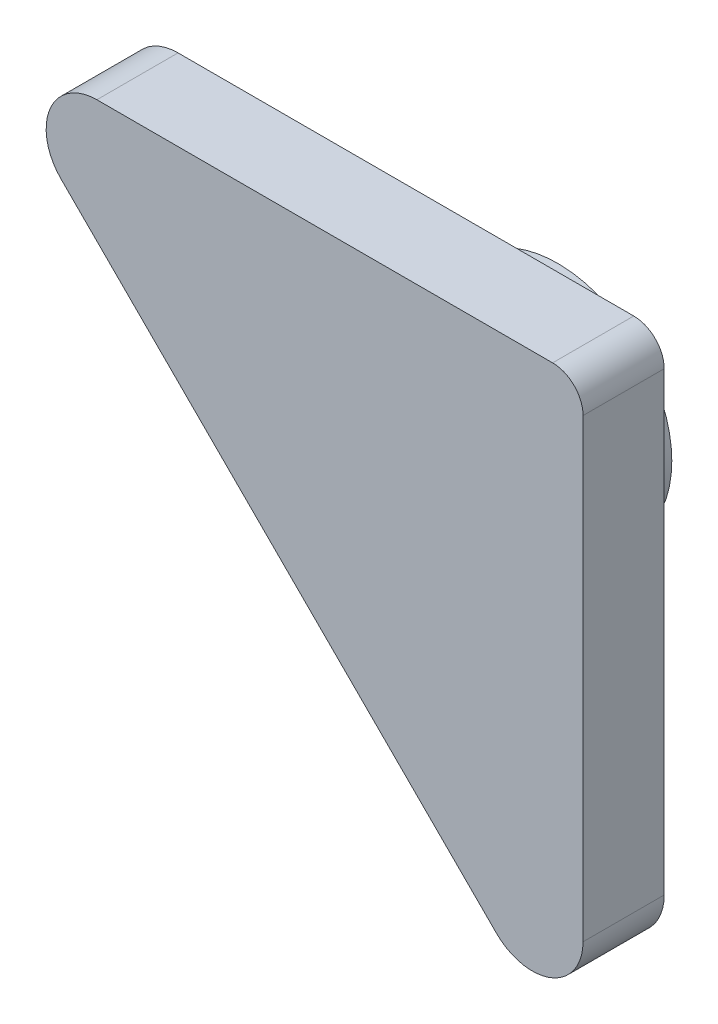
from build123d import *

# Parameters (mm, degrees)
BOSS_EXTRUDE1_DEPTH = 8
SKETCH2_R           = 11.25
BOSS_EXTRUDE2_DEPTH = 6
CUT_EXTRUDE1_START  = -0.8
SKETCH3_R           = 10.2
CUT_EXTRUDE1_DEPTH  = 5.2
FILLET1_R           = 5
FILLET2_R           = 3
SKETCH4_R           = 1.9
CUT_EXTRUDE2_DEPTH  = 4
CUT_EXTRUDE3_DEPTH  = 1


with BuildPart() as part:
    # Sketch1 → Boss-Extrude1 (new body)
    with BuildSketch(Plane.XY):
        Polygon((-43.5, 16.5), (16.5, 16.5), (16.5, -43.5), align=None)
    extrude(amount=BOSS_EXTRUDE1_DEPTH)

    # Sketch2 → Boss-Extrude2 (add)
    with BuildSketch(Plane.XY):
        Circle(SKETCH2_R)
    extrude(amount=-BOSS_EXTRUDE2_DEPTH)

    # Sketch3 → Cut-Extrude1 (cut)
    with BuildSketch(Plane(origin=(0, 0, -6), x_dir=(-1, 0, 0), z_dir=(0, 0, -1)).offset(CUT_EXTRUDE1_START)):
        Circle(SKETCH3_R)
    extrude(amount=-CUT_EXTRUDE1_DEPTH, mode=Mode.SUBTRACT)

    # Fillet1
    fillet1_edges = [part.edges().sort_by_distance(p)[0] for p in [
        (-43.5, 16.5, 4),
        (16.5, -43.5, 4),
    ]]
    fillet(fillet1_edges, radius=FILLET1_R)

    # Fillet2
    fillet2_edges = [part.edges().sort_by_distance(p)[0] for p in [
        (16.5, 16.5, 4),
    ]]
    fillet(fillet2_edges, radius=FILLET2_R)

    # Sketch4 → Cut-Extrude2 (cut)
    with BuildSketch(Plane(origin=(0, 0, 0), x_dir=(-1, 0, 0), z_dir=(0, 0, -1))):
        with Locations((28, 8)):
            Circle(SKETCH4_R)
    extrude(amount=-CUT_EXTRUDE2_DEPTH, mode=Mode.SUBTRACT)

    # Sketch5 → Cut-Extrude3 (cut)
    # profile 1 of 4: a face of its own
    with BuildSketch(Plane(origin=(0, 0, 0), x_dir=(-1, 0, 0), z_dir=(0, 0, -1))):
        with BuildLine():
            Line((-11.659528314, -16.419260987), (-11.973630878, -16.419260987))
            add(Edge.make_bspline(
                [(-11.973630878, -16.419260987), (-11.971583725, -16.377590099), (-11.967563171, -16.295749584), (-11.948734882, -16.176425678), (-11.921794004, -16.062370879), (-11.88370255, -15.954500965), (-11.836396273, -15.851862158), (-11.779666245, -15.754862142), (-11.712472395, -15.663870954), (-11.636265661, -15.57973211), (-11.553497022, -15.50254454), (-11.464191082, -15.435889297), (-11.370346055, -15.379571625), (-11.272246656, -15.332490384), (-11.168786092, -15.297150538), (-11.060903235, -15.270928898), (-10.948124098, -15.255152552), (-10.871284076, -15.253456767), (-10.832204596, -15.25259432)],
                knots=[0, 0, 0, 0, 1.10065271, 2.161652631, 3.183658789, 4.190468796, 5.17591951, 6.163126047, 7.15150782, 8.156236427, 9.156009102, 10.134482811, 11.092018607, 12.041330605, 13.001268258, 13.972401359, 14.968799086, 16, 16, 16, 16], degree=3))
            add(Edge.make_bspline(
                [(-10.832204596, -15.25259432), (-10.793826522, -15.253492777), (-10.718414977, -15.255258211), (-10.608352963, -15.270419241), (-10.503575668, -15.294164832), (-10.404287902, -15.327480249), (-10.311281837, -15.372264676), (-10.223858793, -15.426062215), (-10.140977982, -15.488282046), (-10.066371198, -15.561535859), (-9.997863119, -15.639738244), (-9.938760864, -15.723226148), (-9.8881477, -15.809455433), (-9.84596002, -15.899083635), (-9.814903882, -15.992954663), (-9.791325674, -16.089701866), (-9.77799826, -16.190326677), (-9.775952836, -16.258433233), (-9.774912929, -16.293059064)],
                knots=[0, 0, 0, 0, 1.111607364, 2.184268762, 3.212621178, 4.221274766, 5.211760367, 6.196651075, 7.1921475, 8.207485113, 9.220403448, 10.201281604, 11.166441695, 12.114753415, 13.065576456, 14.026450734, 14.996634279, 16, 16, 16, 16], degree=3))
            add(Edge.make_bspline(
                [(-9.774912929, -16.293059064), (-9.776599574, -16.341808873), (-9.779943266, -16.438453001), (-9.808798968, -16.580657359), (-9.853381065, -16.718562418), (-9.907454095, -16.82954147), (-9.962074662, -16.918518363), (-10.010254458, -16.992434005), (-10.067906811, -17.071260421), (-10.134504224, -17.15579153), (-10.20904203, -17.2462859), (-10.292056698, -17.342780666), (-10.384182389, -17.444250971), (-10.44884057, -17.513556784), (-10.48234482, -17.54946932)],
                knots=[0, 0, 0, 0, 1.184203166, 2.347625244, 3.513805382, 4.700623107, 5.337941753, 6.051866363, 6.845199593, 7.711357327, 8.668078039, 9.695487809, 10.805859518, 12, 12, 12, 12], degree=3))
            Line((-10.48234482, -17.54946932), (-11.358045942, -18.483363551))
            Line((-11.358045942, -18.483363551), (-9.730041134, -18.483363551))
            Line((-9.730041134, -18.483363551), (-9.730041134, -18.84233791))
            Line((-9.730041134, -18.84233791), (-12.108246263, -18.84233791))
            Line((-12.108246263, -18.84233791), (-10.750874468, -17.393820282))
            add(Edge.make_bspline(
                [(-10.750874468, -17.393820282), (-10.717826581, -17.359321975), (-10.654348354, -17.293057788), (-10.564565777, -17.196314828), (-10.483926789, -17.106565288), (-10.411909396, -17.023978739), (-10.350075891, -16.947347171), (-10.295203659, -16.879152468), (-10.251238068, -16.816398017), (-10.203522672, -16.743657404), (-10.157308691, -16.654845086), (-10.117596334, -16.546311397), (-10.093381486, -16.434584144), (-10.090476651, -16.359082107), (-10.089015493, -16.321103935)],
                knots=[0, 0, 0, 0, 1.329631726, 2.553950428, 3.673215718, 4.687767853, 5.603093632, 6.413772471, 7.123043292, 7.734684054, 8.834405432, 9.900288307, 10.943827018, 12, 12, 12, 12], degree=3))
            add(Edge.make_bspline(
                [(-10.089015493, -16.321103935), (-10.089651236, -16.297222537), (-10.090904162, -16.250156887), (-10.101961859, -16.181151128), (-10.118672365, -16.114586314), (-10.142617623, -16.050257695), (-10.174224363, -15.988812043), (-10.212697743, -15.930174562), (-10.257087807, -15.873485597), (-10.308439076, -15.820332299), (-10.364850596, -15.771651094), (-10.424444845, -15.728527008), (-10.48749495, -15.692487898), (-10.553735072, -15.6629444), (-10.622980541, -15.639769019), (-10.695365286, -15.62371044), (-10.770689303, -15.613627956), (-10.822122798, -15.612263784), (-10.848330397, -15.611568679)],
                knots=[0, 0, 0, 0, 0.991446411, 1.95395049, 2.89581595, 3.838931463, 4.798493298, 5.75982156, 6.748411868, 7.785213223, 8.824556874, 9.840280684, 10.836137867, 11.835679398, 12.848801643, 13.863922112, 14.911575587, 16, 16, 16, 16], degree=3))
            add(Edge.make_bspline(
                [(-10.848330397, -15.611568679), (-10.87570123, -15.612283711), (-10.929453026, -15.613687917), (-11.008372059, -15.623510581), (-11.083657837, -15.640456421), (-11.15549974, -15.663633095), (-11.224019325, -15.693091644), (-11.288883369, -15.729783389), (-11.349946259, -15.773566882), (-11.407322782, -15.823207438), (-11.460186761, -15.87847504), (-11.506633637, -15.940085003), (-11.547217651, -16.006912418), (-11.582626885, -16.078776969), (-11.611382575, -16.156330749), (-11.633355725, -16.239298453), (-11.650742572, -16.327319835), (-11.656551092, -16.38810492), (-11.659528314, -16.419260987)],
                knots=[0, 0, 0, 0, 1.031018746, 2.02475058, 2.990194455, 3.934040569, 4.864654155, 5.795059489, 6.735614925, 7.690564532, 8.649604399, 9.611025574, 10.590972636, 11.591080095, 12.624614302, 13.701020113, 14.821632451, 16, 16, 16, 16], degree=3))
        make_face()
    # profile 2 of 4: a face of its own
    with BuildSketch(Plane(origin=(0, 0, 0), x_dir=(-1, 0, 0), z_dir=(0, 0, -1))):
        with BuildLine():
            add(Edge.make_bspline(
                [(-9.41593857, -17.093740153), (-9.415610552, -17.037642766), (-9.414973372, -16.928672781), (-9.407884951, -16.769888139), (-9.396109609, -16.62092785), (-9.379972236, -16.481784784), (-9.360334256, -16.35242302), (-9.334118769, -16.233188263), (-9.304305967, -16.123528656), (-9.269753521, -16.023086608), (-9.230765732, -15.930508905), (-9.188331471, -15.844083703), (-9.140766677, -15.763941771), (-9.090789764, -15.688803981), (-9.036377692, -15.619900286), (-8.979078902, -15.556257623), (-8.916657025, -15.499346873), (-8.851234017, -15.44750057), (-8.782217553, -15.402051099), (-8.711574887, -15.36201836), (-8.638819781, -15.327818493), (-8.563753598, -15.300928057), (-8.48705104, -15.27871721), (-8.408443973, -15.263528263), (-8.327802609, -15.253971354), (-8.273371174, -15.253057686), (-8.245766295, -15.25259432)],
                knots=[0, 0, 0, 0, 1.646270934, 3.197905019, 4.663502075, 6.030701355, 7.308322542, 8.50163776, 9.611534131, 10.641858119, 11.616356847, 12.558055219, 13.465016945, 14.349605745, 15.204443733, 16.039544428, 16.859896111, 17.680448484, 18.487036065, 19.28249412, 20.06191084, 20.843045899, 21.620316918, 22.403196591, 23.190181807, 24, 24, 24, 24], degree=3))
            add(Edge.make_bspline(
                [(-8.245766295, -15.25259432), (-8.217930816, -15.253082135), (-8.162574807, -15.254052246), (-8.080734432, -15.263376189), (-8.00078475, -15.278847312), (-7.923066612, -15.300768286), (-7.846941625, -15.327963963), (-7.773005217, -15.36205108), (-7.700798136, -15.401729948), (-7.631467848, -15.448353825), (-7.564253233, -15.500336101), (-7.50080527, -15.55909877), (-7.441118184, -15.624048489), (-7.384442879, -15.694490353), (-7.332387282, -15.771775438), (-7.282813849, -15.854559548), (-7.238441813, -15.944290412), (-7.195707138, -16.03947088), (-7.158820151, -16.142734539), (-7.125553906, -16.2534993), (-7.098674938, -16.373073486), (-7.076285665, -16.500829732), (-7.058940769, -16.637237215), (-7.046308127, -16.78200353), (-7.039635042, -16.935223921), (-7.038378341, -17.03998177), (-7.037733442, -17.093740153)],
                knots=[0, 0, 0, 0, 0.810914788, 1.612654377, 2.396697861, 3.181598691, 3.963628158, 4.749916497, 5.551656086, 6.361998678, 7.18212741, 8.025565596, 8.878627764, 9.750805457, 10.657531673, 11.591944965, 12.560506719, 13.57287815, 14.630710178, 15.753379473, 16.941251878, 18.199788006, 19.531962791, 20.947069417, 22.433333509, 24, 24, 24, 24], degree=3))
            add(Edge.make_bspline(
                [(-7.037733442, -17.093740153), (-7.038385027, -17.147264061), (-7.039654613, -17.251553213), (-7.046233319, -17.404084189), (-7.05919195, -17.548082232), (-7.075401939, -17.683892694), (-7.097852902, -17.810950313), (-7.125458068, -17.929694762), (-7.156108391, -18.040638833), (-7.193943185, -18.142873645), (-7.235353895, -18.237825368), (-7.280409091, -18.326492516), (-7.328678918, -18.409658809), (-7.381267663, -18.486658556), (-7.437321076, -18.558037213), (-7.498038865, -18.622534835), (-7.56170945, -18.681705507), (-7.629121865, -18.734357135), (-7.699533417, -18.780441939), (-7.771492494, -18.82165579), (-7.846275877, -18.854888485), (-7.92218883, -18.883423526), (-8.000317196, -18.905223978), (-8.080563587, -18.920297833), (-8.162519822, -18.930869682), (-8.217921388, -18.931676162), (-8.245766295, -18.9320815)],
                knots=[0, 0, 0, 0, 1.561518951, 3.042555995, 4.452378317, 5.7783523, 7.031515105, 8.214008947, 9.334062868, 10.386615937, 11.391082383, 12.354592575, 13.286541444, 14.194233754, 15.072674879, 15.931287219, 16.775624067, 17.606195743, 18.42308326, 19.229000347, 20.022332153, 20.807536673, 21.593273796, 22.3848459, 23.188221202, 24, 24, 24, 24], degree=3))
            add(Edge.make_bspline(
                [(-8.245766295, -18.9320815), (-8.273370409, -18.931615144), (-8.327800333, -18.930695582), (-8.408452759, -18.921181851), (-8.486735202, -18.905886347), (-8.563033956, -18.884469743), (-8.637740471, -18.858254907), (-8.709836758, -18.824101223), (-8.780124442, -18.784767155), (-8.848415998, -18.739971733), (-8.913428159, -18.68865005), (-8.975526764, -18.631885761), (-9.033151783, -18.56826235), (-9.086785879, -18.498784427), (-9.137759967, -18.424091185), (-9.18464934, -18.343162811), (-9.228020194, -18.256320201), (-9.267663685, -18.16300229), (-9.302812349, -18.061847362), (-9.333860057, -17.951698184), (-9.358374214, -17.831582548), (-9.37935717, -17.702465181), (-9.396281553, -17.56379125), (-9.407835878, -17.415485472), (-9.414977193, -17.257640263), (-9.415612263, -17.149370489), (-9.41593857, -17.093740153)],
                knots=[0, 0, 0, 0, 0.810891512, 1.598919785, 2.382837074, 3.152667961, 3.926044502, 4.706494248, 5.493654104, 6.291793342, 7.103789334, 7.925228297, 8.761435821, 9.622817696, 10.50288917, 11.416980706, 12.369136599, 13.353924996, 14.394355917, 15.514179734, 16.714354668, 17.994756427, 19.357759367, 20.818452758, 22.365282078, 24, 24, 24, 24], degree=3))
        make_face()
        with BuildLine():
            add(Edge.make_bspline(
                [(-9.101836006, -17.09233791), (-9.101716559, -17.139086609), (-9.101484736, -17.229816653), (-9.095428535, -17.361659914), (-9.087178303, -17.484630243), (-9.076537006, -17.59888378), (-9.060734058, -17.704033792), (-9.04302727, -17.800803475), (-9.02147918, -17.888680712), (-8.995984162, -17.968268523), (-8.966945065, -18.040917592), (-8.935239202, -18.108518807), (-8.901178479, -18.171870743), (-8.863059328, -18.230404352), (-8.821544265, -18.284310516), (-8.777571006, -18.334543348), (-8.729498422, -18.379340329), (-8.662994679, -18.433067184), (-8.575198205, -18.488586318), (-8.464577749, -18.536932408), (-8.350909298, -18.567314864), (-8.273758048, -18.57117862), (-8.235249468, -18.573107141)],
                knots=[0, 0, 0, 0, 1.459021318, 2.831673884, 4.118529203, 5.306027144, 6.411944654, 7.436330062, 8.375795394, 9.233974572, 10.042671642, 10.816086306, 11.563610507, 12.285937304, 12.993564865, 13.685989202, 14.367179055, 15.041617293, 16.353048772, 17.594441528, 18.799311195, 20, 20, 20, 20], degree=3))
            add(Edge.make_bspline(
                [(-8.235249468, -18.573107141), (-8.196491796, -18.57150936), (-8.119056473, -18.568317097), (-8.005922678, -18.53751836), (-7.896092408, -18.49104882), (-7.810020467, -18.436101315), (-7.744537924, -18.383772985), (-7.697620934, -18.339158337), (-7.654558885, -18.28920247), (-7.61371681, -18.235303174), (-7.576257735, -18.17643069), (-7.542194597, -18.112868114), (-7.51111125, -18.044438936), (-7.493402204, -17.996669197), (-7.484348025, -17.972245762)],
                knots=[0, 0, 0, 0, 1.353760809, 2.704726607, 4.075137775, 5.516104923, 6.260822281, 7.007110065, 7.778089737, 8.566572457, 9.372053459, 10.217411131, 11.088608312, 12, 12, 12, 12], degree=3))
            add(Edge.make_bspline(
                [(-7.484348025, -17.972245762), (-7.473796258, -17.941016023), (-7.452371644, -17.877606259), (-7.42475987, -17.779242607), (-7.40301447, -17.676039843), (-7.383451105, -17.568614726), (-7.370098049, -17.456175025), (-7.359350235, -17.339068641), (-7.353019548, -17.217207279), (-7.352234797, -17.134412288), (-7.351836006, -17.09233791)],
                knots=[0, 0, 0, 0, 0.884706709, 1.796334032, 2.740027952, 3.714592787, 4.726048262, 5.777819803, 6.87074269, 8, 8, 8, 8], degree=3))
            add(Edge.make_bspline(
                [(-7.351836006, -17.09233791), (-7.352386195, -17.050270337), (-7.353462483, -16.967977173), (-7.357576471, -16.847458992), (-7.368200045, -16.732991231), (-7.379999164, -16.624080758), (-7.397396385, -16.521330456), (-7.416154192, -16.42388015), (-7.441355404, -16.332937126), (-7.468275179, -16.247077544), (-7.499085575, -16.167276889), (-7.533001309, -16.093163103), (-7.569223068, -16.024378378), (-7.608565308, -15.961111437), (-7.650560992, -15.903078894), (-7.696318541, -15.851444299), (-7.744022914, -15.804607331), (-7.810840099, -15.751144762), (-7.898314389, -15.696633066), (-8.007160037, -15.646467307), (-8.120430681, -15.617659014), (-8.197004135, -15.613597327), (-8.235249468, -15.611568679)],
                knots=[0, 0, 0, 0, 1.31362396, 2.569729283, 3.763502607, 4.902122613, 5.988968491, 7.01645872, 7.998833611, 8.933434873, 9.825090667, 10.667526885, 11.477055099, 12.250526234, 12.991942729, 13.710640831, 14.402115721, 15.076753259, 16.378508321, 17.609869233, 18.806226677, 20, 20, 20, 20], degree=3))
            add(Edge.make_bspline(
                [(-8.235249468, -15.611568679), (-8.27396006, -15.613600126), (-8.351451765, -15.61766672), (-8.46589972, -15.646359973), (-8.575604072, -15.696372939), (-8.662847046, -15.751325312), (-8.729710833, -15.803663623), (-8.776793526, -15.849050077), (-8.820939699, -15.898696332), (-8.861607399, -15.953098247), (-8.899696682, -16.011563614), (-8.934677694, -16.074552379), (-8.966195024, -16.142383743), (-8.99527956, -16.215000178), (-9.020852348, -16.294581123), (-9.041946312, -16.382350116), (-9.061433365, -16.478812008), (-9.075228634, -16.584531516), (-9.087492389, -16.698813669), (-9.095373737, -16.822090988), (-9.101504995, -16.954155368), (-9.101723459, -17.045354526), (-9.101836006, -17.09233791)],
                knots=[0, 0, 0, 0, 1.207732386, 2.417664972, 3.655092373, 4.956220595, 5.625982001, 6.301752483, 6.994047911, 7.697131622, 8.419323945, 9.170223765, 9.943494443, 10.752040957, 11.610060368, 12.549350801, 13.567764191, 14.679664412, 15.874934091, 17.154273443, 18.533957287, 20, 20, 20, 20], degree=3))
        make_face(mode=Mode.SUBTRACT)
    # profile 3 of 4: a face of its own
    with BuildSketch(Plane(origin=(0, 0, 0), x_dir=(-1, 0, 0), z_dir=(0, 0, -1))):
        with BuildLine():
            Line((-6.499271904, -16.284645602), (-6.18516934, -16.284645602))
            Line((-6.18516934, -16.284645602), (-6.18516934, -16.72915682))
            add(Edge.make_bspline(
                [(-6.18516934, -16.72915682), (-6.15688539, -16.690269218), (-6.10269063, -16.615756845), (-6.013824977, -16.517566561), (-5.925048865, -16.434238406), (-5.861115483, -16.390495535), (-5.830401711, -16.369481339)],
                knots=[0, 0, 0, 0, 1.134379233, 2.173579362, 3.122582517, 4, 4, 4, 4], degree=3))
            add(Edge.make_bspline(
                [(-5.830401711, -16.369481339), (-5.788537049, -16.349475974), (-5.705539149, -16.309814761), (-5.574119924, -16.269581202), (-5.439645255, -16.2448561), (-5.348837041, -16.241474727), (-5.303158122, -16.239773807)],
                knots=[0, 0, 0, 0, 1.014936303, 2.012140481, 3.000054389, 4, 4, 4, 4], degree=3))
            add(Edge.make_bspline(
                [(-5.303158122, -16.239773807), (-5.272265125, -16.240819098), (-5.211129546, -16.242887672), (-5.120545456, -16.256347707), (-5.032686844, -16.27961388), (-4.948072815, -16.312021204), (-4.868352135, -16.351267891), (-4.795262938, -16.397317599), (-4.729638729, -16.449014675), (-4.671512678, -16.508693608), (-4.619243653, -16.578030206), (-4.571164806, -16.658894455), (-4.526739594, -16.753102116), (-4.502118285, -16.821468657), (-4.489155718, -16.857462109)],
                knots=[0, 0, 0, 0, 1.009824226, 1.998387844, 2.986035974, 3.974953746, 4.955485308, 5.885931332, 6.793869504, 7.679848016, 8.601185859, 9.625726857, 10.749998409, 12, 12, 12, 12], degree=3))
            add(Edge.make_bspline(
                [(-4.489155718, -16.857462109), (-4.475444466, -16.832737689), (-4.448462649, -16.784083504), (-4.403157012, -16.715225242), (-4.355689216, -16.65081845), (-4.305654723, -16.590812026), (-4.253230136, -16.535502295), (-4.198168735, -16.484706394), (-4.140783954, -16.43820618), (-4.060991714, -16.383883021), (-3.957179107, -16.326181839), (-3.826290992, -16.276153395), (-3.69014082, -16.245237267), (-3.597723122, -16.241606994), (-3.551054756, -16.239773807)],
                knots=[0, 0, 0, 0, 0.86119277, 1.694706429, 2.50939023, 3.298075842, 4.073795165, 4.829715201, 5.57930267, 6.321991688, 7.768977793, 9.186738141, 10.579381044, 12, 12, 12, 12], degree=3))
            add(Edge.make_bspline(
                [(-3.551054756, -16.239773807), (-3.508173293, -16.241391028), (-3.424250107, -16.244556086), (-3.302072841, -16.26940956), (-3.188131036, -16.312087207), (-3.08265396, -16.370320843), (-2.987494147, -16.443500027), (-2.904777837, -16.530568864), (-2.835007474, -16.630911487), (-2.789428834, -16.725303476), (-2.75851357, -16.808638809), (-2.739452336, -16.8796451), (-2.722612641, -16.957796653), (-2.708631395, -17.043186915), (-2.698412843, -17.136117523), (-2.690842128, -17.236436399), (-2.685718054, -17.34422151), (-2.685355982, -17.418587011), (-2.68516934, -17.456921243)],
                knots=[0, 0, 0, 0, 1.209669288, 2.367440248, 3.500751976, 4.631527125, 5.755587489, 6.87532382, 8.007944318, 9.190864318, 9.82315674, 10.514484317, 11.263564316, 12.079023757, 12.955305781, 13.901327259, 14.918167583, 16, 16, 16, 16], degree=3))
            Line((-2.68516934, -17.456921243), (-2.68516934, -18.84233791))
            Line((-2.68516934, -18.84233791), (-2.999271904, -18.84233791))
            Line((-2.999271904, -18.84233791), (-2.999271904, -17.455519))
            add(Edge.make_bspline(
                [(-2.999271904, -17.455519), (-2.999349787, -17.422798426), (-2.999499466, -17.359914459), (-3.002193097, -17.269662008), (-3.007268411, -17.18739365), (-3.01320305, -17.113221562), (-3.02144686, -17.046972774), (-3.032092791, -16.988780355), (-3.043370471, -16.938186544), (-3.062106462, -16.882100496), (-3.092054354, -16.820230286), (-3.137671834, -16.75350671), (-3.19514194, -16.69542591), (-3.261502097, -16.645007593), (-3.337050542, -16.604013952), (-3.420315265, -16.574737942), (-3.510779316, -16.556615064), (-3.573402105, -16.554809048), (-3.605742256, -16.553876371)],
                knots=[0, 0, 0, 0, 1.253487763, 2.409012846, 3.458416907, 4.410876679, 5.259312806, 6.014470957, 6.676830364, 7.243083969, 8.276244668, 9.299465089, 10.325150304, 11.392391894, 12.482080715, 13.603491619, 14.762376348, 16, 16, 16, 16], degree=3))
            add(Edge.make_bspline(
                [(-3.605742256, -16.553876371), (-3.645412211, -16.555292529), (-3.723815122, -16.558091394), (-3.838260608, -16.586665267), (-3.948231625, -16.629745518), (-4.050446757, -16.692177975), (-4.144474548, -16.766986339), (-4.225374126, -16.855935934), (-4.292206312, -16.956565861), (-4.337460287, -17.049712564), (-4.366049589, -17.133382008), (-4.384926504, -17.20647938), (-4.399609896, -17.289560947), (-4.413380425, -17.382068438), (-4.422368153, -17.484638619), (-4.430536525, -17.59679702), (-4.434357388, -17.718880979), (-4.434891847, -17.803507668), (-4.43516934, -17.847446083)],
                knots=[0, 0, 0, 0, 1.090531906, 2.155305635, 3.229839962, 4.33261226, 5.44038871, 6.529323825, 7.629011124, 8.757537029, 9.370236727, 10.061839251, 10.834451254, 11.692844982, 12.636905849, 13.66920014, 14.789842145, 16, 16, 16, 16], degree=3))
            Line((-4.43516934, -17.847446083), (-4.43516934, -18.84233791))
            Line((-4.43516934, -18.84233791), (-4.749271904, -18.84233791))
            Line((-4.749271904, -18.84233791), (-4.749271904, -17.54175698))
            add(Edge.make_bspline(
                [(-4.749271904, -17.54175698), (-4.749351335, -17.505063662), (-4.749504152, -17.434469404), (-4.752180469, -17.333235729), (-4.757267091, -17.241154649), (-4.763147639, -17.158333185), (-4.771607818, -17.084921856), (-4.78121758, -17.020527098), (-4.79256619, -16.965310347), (-4.811356075, -16.904746962), (-4.840070543, -16.838026039), (-4.886258805, -16.766885018), (-4.943866386, -16.704616921), (-5.011437261, -16.651458172), (-5.087442944, -16.607516691), (-5.171426344, -16.575856939), (-5.262631257, -16.55743265), (-5.325508963, -16.555084153), (-5.357845622, -16.553876371)],
                knots=[0, 0, 0, 0, 1.320475261, 2.540461679, 3.643808994, 4.639130445, 5.527981419, 6.302341397, 6.981980563, 7.553956391, 8.582137848, 9.585246428, 10.591171744, 11.620968678, 12.668337649, 13.738356861, 14.836885341, 16, 16, 16, 16], degree=3))
            add(Edge.make_bspline(
                [(-5.357845622, -16.553876371), (-5.395861833, -16.555406831), (-5.471626792, -16.558456984), (-5.582928762, -16.585911258), (-5.690414446, -16.628915332), (-5.792369144, -16.688575152), (-5.886043293, -16.76247423), (-5.96805156, -16.849389126), (-6.036994086, -16.948238159), (-6.082725901, -17.040402676), (-6.112224375, -17.121975951), (-6.131819709, -17.191326899), (-6.148659335, -17.268327147), (-6.161173357, -17.353214258), (-6.173253772, -17.445435352), (-6.179084082, -17.545449842), (-6.184755644, -17.653171929), (-6.185028058, -17.727544475), (-6.18516934, -17.766115955)],
                knots=[0, 0, 0, 0, 1.098833095, 2.189935336, 3.297829714, 4.440610912, 5.596351641, 6.740013378, 7.886572111, 9.072425424, 9.705826452, 10.395263256, 11.156850408, 11.985370555, 12.878090359, 13.847760091, 14.883794034, 16, 16, 16, 16], degree=3))
            Line((-6.18516934, -17.766115955), (-6.18516934, -18.84233791))
            Line((-6.18516934, -18.84233791), (-6.499271904, -18.84233791))
            Line((-6.499271904, -18.84233791), (-6.499271904, -16.284645602))
        make_face()
    # profile 4 of 4: a face of its own
    with BuildSketch(Plane(origin=(0, 0, 0), x_dir=(-1, 0, 0), z_dir=(0, 0, -1))):
        with BuildLine():
            Line((-1.967220622, -16.284645602), (-1.653118057, -16.284645602))
            Line((-1.653118057, -16.284645602), (-1.653118057, -16.72915682))
            add(Edge.make_bspline(
                [(-1.653118057, -16.72915682), (-1.624834108, -16.690269218), (-1.570639348, -16.615756845), (-1.481773695, -16.517566561), (-1.392997583, -16.434238406), (-1.329064201, -16.390495535), (-1.298350429, -16.369481339)],
                knots=[0, 0, 0, 0, 1.134379233, 2.173579362, 3.122582517, 4, 4, 4, 4], degree=3))
            add(Edge.make_bspline(
                [(-1.298350429, -16.369481339), (-1.256485767, -16.349475974), (-1.173487867, -16.309814761), (-1.042068642, -16.269581202), (-0.907593973, -16.2448561), (-0.816785759, -16.241474727), (-0.77110684, -16.239773807)],
                knots=[0, 0, 0, 0, 1.014936303, 2.012140481, 3.000054389, 4, 4, 4, 4], degree=3))
            add(Edge.make_bspline(
                [(-0.77110684, -16.239773807), (-0.740213843, -16.240819098), (-0.679078264, -16.242887672), (-0.588494174, -16.256347707), (-0.500635562, -16.27961388), (-0.416021533, -16.312021204), (-0.336300853, -16.351267891), (-0.263211656, -16.397317599), (-0.197587447, -16.449014675), (-0.139461396, -16.508693608), (-0.087192371, -16.578030206), (-0.039113524, -16.658894455), (0.005311688, -16.753102116), (0.029932997, -16.821468657), (0.042895564, -16.857462109)],
                knots=[0, 0, 0, 0, 1.009824226, 1.998387844, 2.986035974, 3.974953746, 4.955485308, 5.885931332, 6.793869504, 7.679848016, 8.601185859, 9.625726857, 10.749998409, 12, 12, 12, 12], degree=3))
            add(Edge.make_bspline(
                [(0.042895564, -16.857462109), (0.056606816, -16.832737689), (0.083588633, -16.784083504), (0.12889427, -16.715225242), (0.176362066, -16.65081845), (0.226396559, -16.590812026), (0.278821146, -16.535502295), (0.333882547, -16.484706394), (0.391267328, -16.43820618), (0.471059568, -16.383883021), (0.574872175, -16.326181839), (0.70576029, -16.276153395), (0.841910462, -16.245237267), (0.93432816, -16.241606994), (0.980996526, -16.239773807)],
                knots=[0, 0, 0, 0, 0.86119277, 1.694706429, 2.50939023, 3.298075842, 4.073795165, 4.829715201, 5.57930267, 6.321991688, 7.768977793, 9.186738141, 10.579381044, 12, 12, 12, 12], degree=3))
            add(Edge.make_bspline(
                [(0.980996526, -16.239773807), (1.023877989, -16.241391028), (1.107801175, -16.244556086), (1.229978441, -16.26940956), (1.343920246, -16.312087207), (1.449397322, -16.370320843), (1.544557136, -16.443500027), (1.627273445, -16.530568864), (1.697043808, -16.630911487), (1.742622448, -16.725303476), (1.773537712, -16.808638809), (1.792598946, -16.8796451), (1.809438641, -16.957796653), (1.823419887, -17.043186915), (1.833638439, -17.136117523), (1.841209154, -17.236436399), (1.846333228, -17.34422151), (1.8466953, -17.418587011), (1.846881943, -17.456921243)],
                knots=[0, 0, 0, 0, 1.209669288, 2.367440248, 3.500751976, 4.631527125, 5.755587489, 6.87532382, 8.007944318, 9.190864318, 9.82315674, 10.514484317, 11.263564316, 12.079023757, 12.955305781, 13.901327259, 14.918167583, 16, 16, 16, 16], degree=3))
            Line((1.846881943, -17.456921243), (1.846881943, -18.84233791))
            Line((1.846881943, -18.84233791), (1.532779378, -18.84233791))
            Line((1.532779378, -18.84233791), (1.532779378, -17.455519))
            add(Edge.make_bspline(
                [(1.532779378, -17.455519), (1.532701495, -17.422798426), (1.532551816, -17.359914459), (1.529858185, -17.269662008), (1.524782871, -17.18739365), (1.518848232, -17.113221562), (1.510604422, -17.046972774), (1.499958491, -16.988780355), (1.488680811, -16.938186544), (1.46994482, -16.882100496), (1.439996928, -16.820230286), (1.394379448, -16.75350671), (1.336909342, -16.69542591), (1.270549185, -16.645007593), (1.195000741, -16.604013952), (1.111736017, -16.574737942), (1.021271966, -16.556615064), (0.958649177, -16.554809048), (0.926309026, -16.553876371)],
                knots=[0, 0, 0, 0, 1.253487763, 2.409012846, 3.458416907, 4.410876679, 5.259312806, 6.014470957, 6.676830364, 7.243083969, 8.276244668, 9.299465089, 10.325150304, 11.392391894, 12.482080715, 13.603491619, 14.762376348, 16, 16, 16, 16], degree=3))
            add(Edge.make_bspline(
                [(0.926309026, -16.553876371), (0.886639072, -16.555292529), (0.80823616, -16.558091394), (0.693790674, -16.586665267), (0.583819658, -16.629745518), (0.481604525, -16.692177975), (0.387576734, -16.766986339), (0.306677156, -16.855935934), (0.239844971, -16.956565861), (0.194590995, -17.049712564), (0.166001693, -17.133382008), (0.147124778, -17.20647938), (0.132441386, -17.289560947), (0.118670857, -17.382068438), (0.109683129, -17.484638619), (0.101514757, -17.59679702), (0.097693894, -17.718880979), (0.097159435, -17.803507668), (0.096881943, -17.847446083)],
                knots=[0, 0, 0, 0, 1.090531906, 2.155305635, 3.229839962, 4.33261226, 5.44038871, 6.529323825, 7.629011124, 8.757537029, 9.370236727, 10.061839251, 10.834451254, 11.692844982, 12.636905849, 13.66920014, 14.789842145, 16, 16, 16, 16], degree=3))
            Line((0.096881943, -17.847446083), (0.096881943, -18.84233791))
            Line((0.096881943, -18.84233791), (-0.217220622, -18.84233791))
            Line((-0.217220622, -18.84233791), (-0.217220622, -17.54175698))
            add(Edge.make_bspline(
                [(-0.217220622, -17.54175698), (-0.217300053, -17.505063662), (-0.21745287, -17.434469404), (-0.220129187, -17.333235729), (-0.225215809, -17.241154649), (-0.231096357, -17.158333185), (-0.239556536, -17.084921856), (-0.249166298, -17.020527098), (-0.260514908, -16.965310347), (-0.279304793, -16.904746962), (-0.308019261, -16.838026039), (-0.354207523, -16.766885018), (-0.411815104, -16.704616921), (-0.479385979, -16.651458172), (-0.555391662, -16.607516691), (-0.639375062, -16.575856939), (-0.730579975, -16.55743265), (-0.793457681, -16.555084153), (-0.82579434, -16.553876371)],
                knots=[0, 0, 0, 0, 1.320475261, 2.540461679, 3.643808994, 4.639130445, 5.527981419, 6.302341397, 6.981980563, 7.553956391, 8.582137848, 9.585246428, 10.591171744, 11.620968678, 12.668337649, 13.738356861, 14.836885341, 16, 16, 16, 16], degree=3))
            add(Edge.make_bspline(
                [(-0.82579434, -16.553876371), (-0.863810551, -16.555406831), (-0.93957551, -16.558456984), (-1.05087748, -16.585911258), (-1.158363164, -16.628915332), (-1.260317862, -16.688575152), (-1.353992011, -16.76247423), (-1.436000278, -16.849389126), (-1.504942804, -16.948238159), (-1.550674618, -17.040402676), (-1.580173093, -17.121975951), (-1.599768427, -17.191326899), (-1.616608053, -17.268327147), (-1.629122075, -17.353214258), (-1.64120249, -17.445435352), (-1.647032799, -17.545449842), (-1.652704362, -17.653171929), (-1.652976776, -17.727544475), (-1.653118057, -17.766115955)],
                knots=[0, 0, 0, 0, 1.098833095, 2.189935336, 3.297829714, 4.440610912, 5.596351641, 6.740013378, 7.886572111, 9.072425424, 9.705826452, 10.395263256, 11.156850408, 11.985370555, 12.878090359, 13.847760091, 14.883794034, 16, 16, 16, 16], degree=3))
            Line((-1.653118057, -17.766115955), (-1.653118057, -18.84233791))
            Line((-1.653118057, -18.84233791), (-1.967220622, -18.84233791))
            Line((-1.967220622, -18.84233791), (-1.967220622, -16.284645602))
        make_face()
    extrude(amount=-CUT_EXTRUDE3_DEPTH, mode=Mode.SUBTRACT)


solid = part.part
